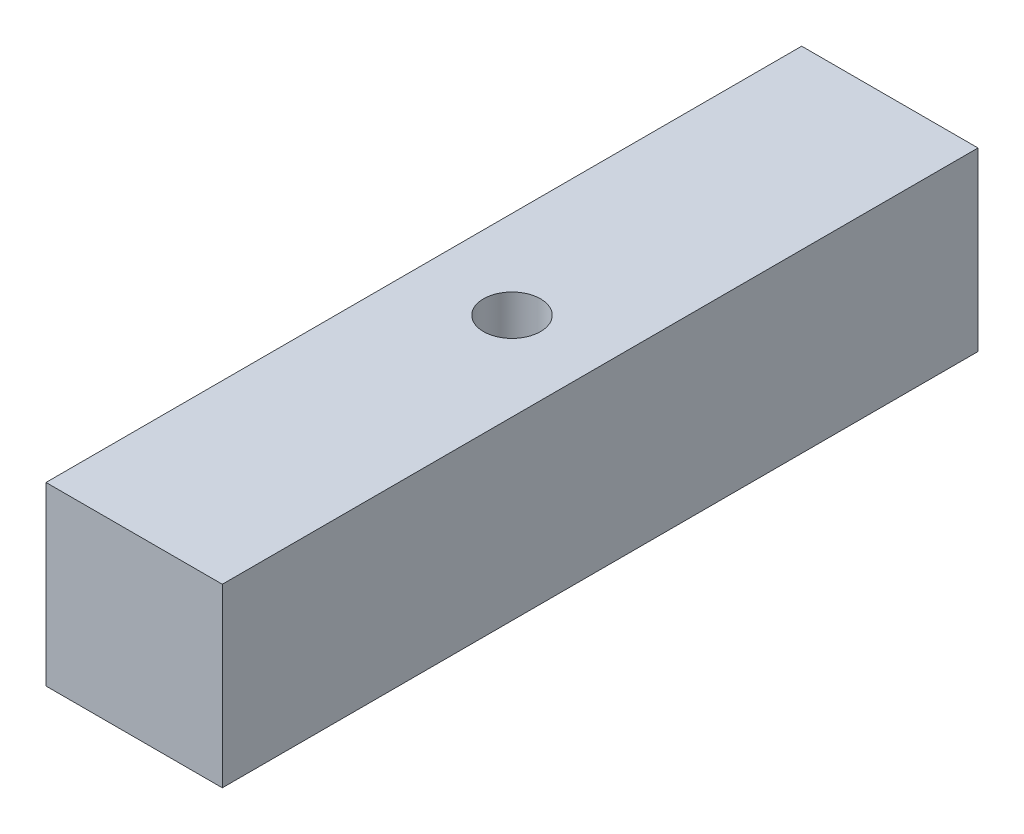
from build123d import *

# Parameters (mm, degrees)
SKETCH1_W           = 7
SKETCH1_H           = 7
BOSS_EXTRUDE1_DEPTH = 30
SKETCH4_R           = 1.1303
CUT_EXTRUDE3_DEPTH  = 32.591137998


with BuildPart() as part:
    # Sketch1 → Boss-Extrude1 (new body)
    with BuildSketch(Plane.XY):
        with Locations((3.5, 3.5)):
            Rectangle(SKETCH1_W, SKETCH1_H)
    extrude(amount=BOSS_EXTRUDE1_DEPTH)

    # Sketch4 → Cut-Extrude3 (cut, through all)
    with BuildSketch(Plane(origin=(0, 7, 0), x_dir=(1, 0, 0), z_dir=(0, 1, 0))):
        with Locations(Location((3.5, -15, 0), (0, 0, 180))):
            Circle(SKETCH4_R)
    extrude(amount=-CUT_EXTRUDE3_DEPTH, mode=Mode.SUBTRACT)


solid = part.part
